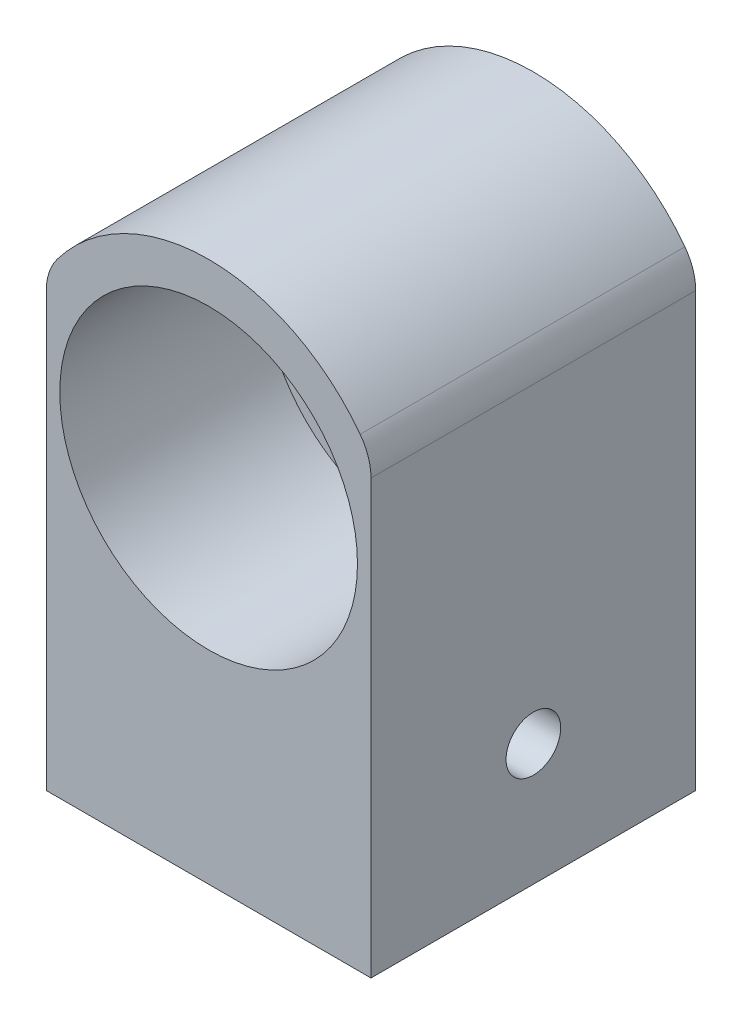
from build123d import *

# Parameters (mm, degrees)
SKETCH1_W           = 76.2
SKETCH1_H           = 76.2
BOSS_EXTRUDE1_DEPTH = 127
SKETCH3_R           = 34.925
CUT_EXTRUDE1_DEPTH  = 47.625
CUT_EXTRUDE3_DEPTH  = 20.6375
CUT_EXTRUDE4_REACH  = 145.763
SKETCH6_R           = 20.955
CUT_EXTRUDE5_START  = -76.2
CUT_EXTRUDE5_DEPTH  = 76.2
FILLET1_R           = 12.7
SKETCH8_R           = 6.4135
CUT_EXTRUDE6_DEPTH  = 153.928251151
CIRPATTERN1_COUNT   = 6


with BuildPart() as part:
    # Sketch1 → Boss-Extrude1 (new body)
    with BuildSketch(Plane(origin=(0, 0, 0), x_dir=(1, 0, 0), z_dir=(0, 1, 0))):
        Rectangle(SKETCH1_W, SKETCH1_H)
    extrude(amount=BOSS_EXTRUDE1_DEPTH)

    # Sketch3 → Cut-Extrude1 (cut)
    with BuildSketch(Plane.XY.offset(38.1)):
        with Locations((0, 82.55)):
            Circle(SKETCH3_R)
    extrude(amount=-CUT_EXTRUDE1_DEPTH, mode=Mode.SUBTRACT)

    # Sketch5 → Cut-Extrude3 (cut)
    with BuildSketch(Plane(origin=(0, 0, -38.1), x_dir=(-1, 0, 0), z_dir=(0, 0, -1))):
        Polygon((22.225, 73.344103576), (22.225, 91.755896424), (9.205896424, 104.775), (-9.205896424, 104.775), (-22.225, 91.755896424), (-22.225, 73.344103576), (-9.205896424, 60.325), (9.205896424, 60.325), align=None)
    extrude(amount=-CUT_EXTRUDE3_DEPTH, mode=Mode.SUBTRACT)

    # Sketch6 → Cut-Extrude4 (cut, up to next)
    with BuildSketch(Plane(origin=(0, 0, -17.4625), x_dir=(-1, 0, 0), z_dir=(0, 0, -1)), mode=Mode.PRIVATE) as cut_extrude4_sk1:
        with Locations((0, 82.55)):
            Circle(SKETCH6_R)
    cut_extrude4_tool1 = extrude(cut_extrude4_sk1.sketch, amount=-CUT_EXTRUDE4_REACH, mode=Mode.PRIVATE) & part.part
    add(cut_extrude4_tool1.solids().sort_by_distance((0, 82.55, -17.4625))[0], mode=Mode.SUBTRACT)

    # Sketch7 → Cut-Extrude5 (cut)
    with BuildSketch(Plane.XY.offset(38.1).offset(CUT_EXTRUDE5_START)):
        with BuildLine():
            Line((-38.1, 105.445250599), (-38.1, 130.845250599))
            Line((-38.1, 130.845250599), (38.1, 130.845250599))
            Line((38.1, 130.845250599), (38.1, 105.445250599))
            ThreePointArc((38.1, 105.445250599), (0, 127), (-38.1, 105.445250599))
        make_face()
    extrude(amount=CUT_EXTRUDE5_DEPTH, mode=Mode.SUBTRACT)

    # Fillet1
    fillet1_edges = [part.edges().sort_by_distance(p)[0] for p in [
        (-38.1, 105.445250599, 0),
        (38.1, 105.445250599, 0),
    ]]
    fillet(fillet1_edges, radius=FILLET1_R)

    # Sketch8 → Cut-Extrude6 (cut, through all)
    with BuildSketch(Plane(origin=(38.1, 0, 0), x_dir=(0, 0, -1), z_dir=(1, 0, 0))):
        with Locations((0, 28.575)):
            Circle(SKETCH8_R)
    extrude(amount=-CUT_EXTRUDE6_DEPTH, mode=Mode.SUBTRACT)

    # Sketch12 → #10 (0.1935) Diameter Hole1 (revolve, cut)
    with BuildSketch(Plane(origin=(-38.1, 28.575, 23.8125), x_dir=(0, 0, 1), z_dir=(0, 1, 0))):
        Polygon((0, 0), (0, 10.717332791), (1.984375, 9.525), (1.984375, 0), align=None)
    f_10_0_1935_diameter_hole1 = revolve(axis=Axis((-44.45, 28.575, 23.8125), (1, 0, 0)), mode=Mode.SUBTRACT)

    # CirPattern1: #10 (0.1935) Diameter Hole1 ×6 about axis
    cirpattern1_axis = Axis((0, 28.575, 0), (1, 0, 0))
    for i in range(1, CIRPATTERN1_COUNT):
        add(f_10_0_1935_diameter_hole1.rotate(cirpattern1_axis, i * 360 / CIRPATTERN1_COUNT), mode=Mode.SUBTRACT)


solid = part.part
